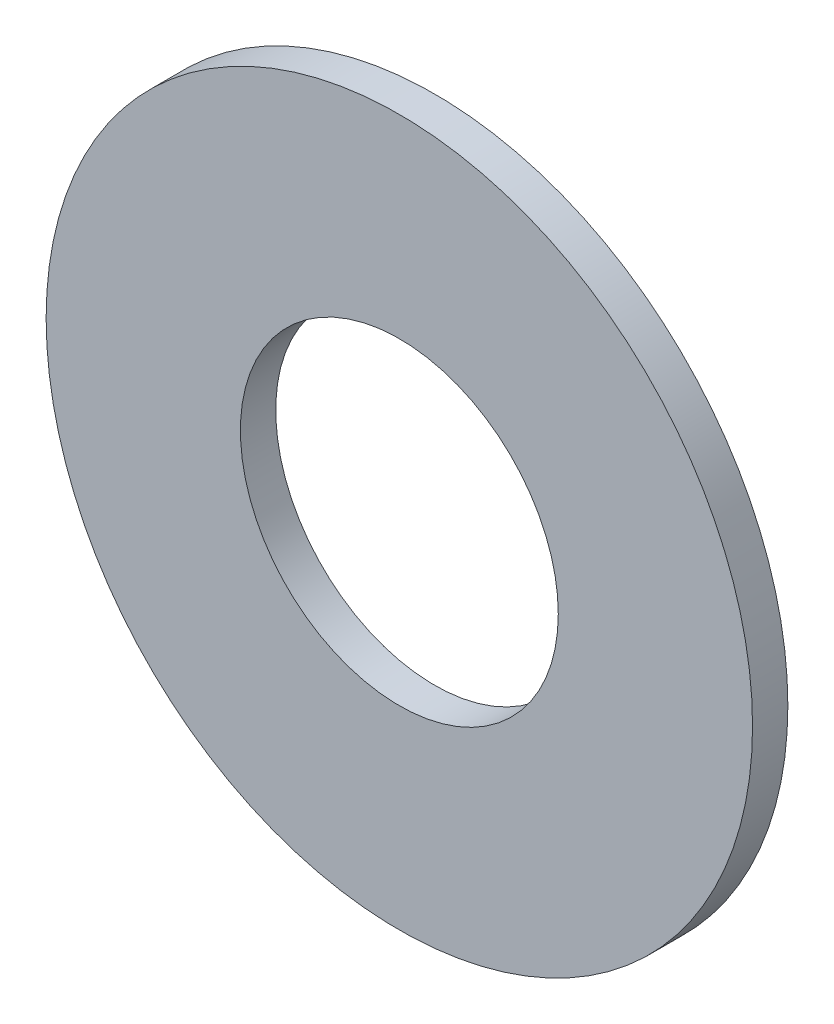
from build123d import *

# Parameters (mm, degrees)
SKETCH1_R           = 10
SKETCH1_R_2         = 4.5
BOSS_EXTRUDE1_DEPTH = 1


with BuildPart() as part:
    # Sketch1 → Boss-Extrude1 (new body)
    with BuildSketch(Plane.XY):
        Circle(SKETCH1_R)
        Circle(SKETCH1_R_2, mode=Mode.SUBTRACT)
    extrude(amount=-BOSS_EXTRUDE1_DEPTH)


solid = part.part
